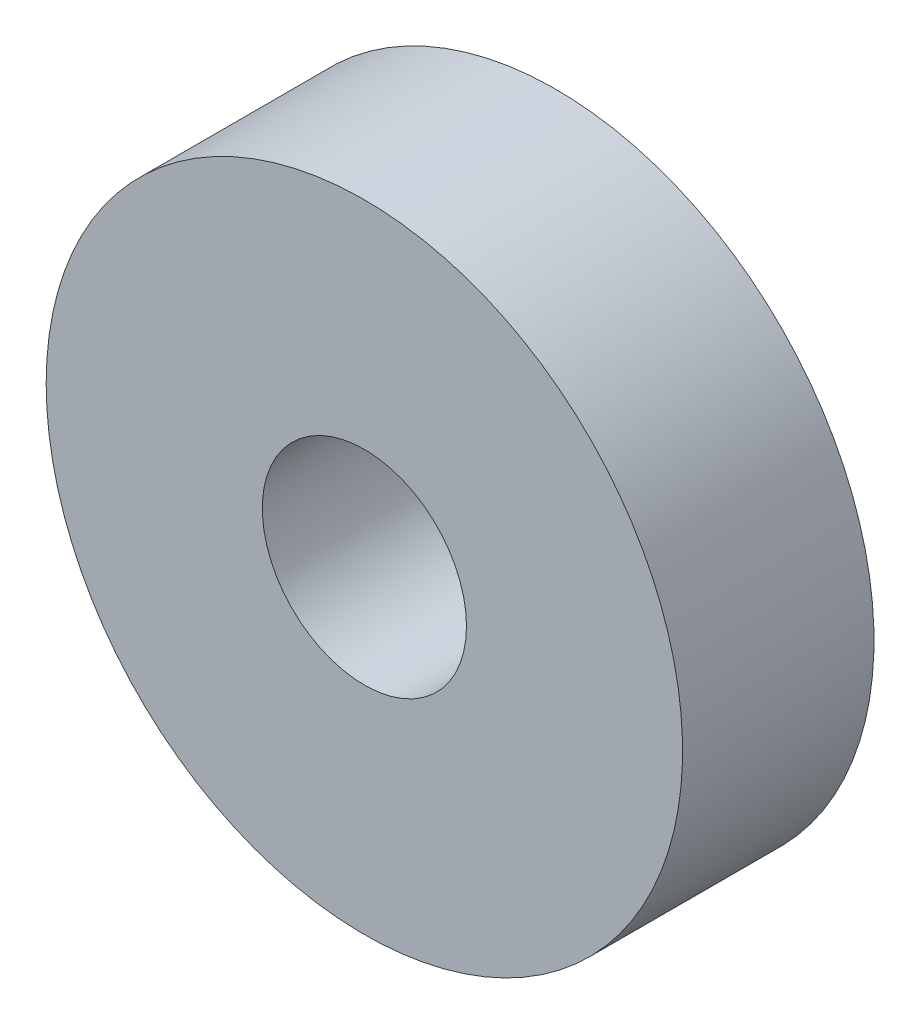
from build123d import *

# Parameters (mm, degrees)
SKETCH_1_W          = 3.637162012
SKETCH_1_H          = 3
SKETCH_2_R          = 1.6
CUT_EXTRUDE_1_DEPTH = 8.664435392


with BuildPart() as part:
    # 草图1 → 旋转1 (revolve)
    with BuildSketch(Plane.XZ, mode=Mode.PRIVATE) as revolve_1_sk:
        with Locations((3.168581006, 1.5)):
            Rectangle(SKETCH_1_W, SKETCH_1_H)
    revolve(revolve_1_sk.sketch.rotate(Axis((0, 0, 3), (0, 0, -1)), 180), axis=Axis((0, 0, 3), (0, 0, -1)))

    # 草图2 → 切除-拉伸1 (cut, through all)
    with BuildSketch(Plane.XY.offset(3)):
        Circle(SKETCH_2_R)
    extrude(amount=-CUT_EXTRUDE_1_DEPTH, mode=Mode.SUBTRACT)


solid = part.part
